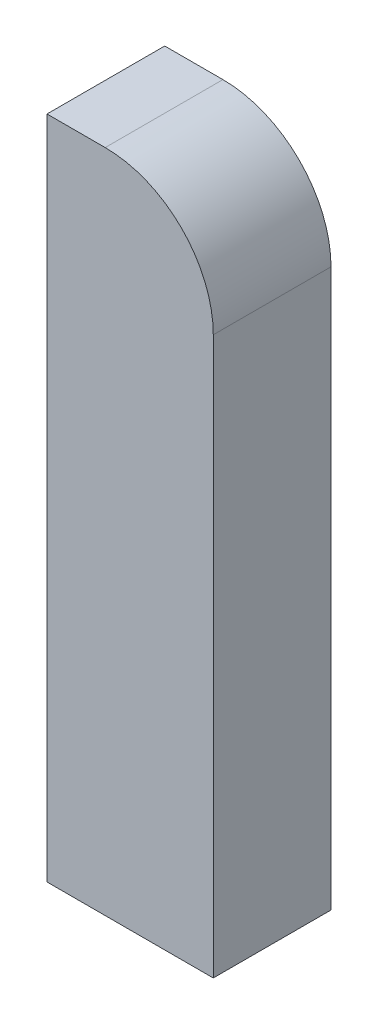
from build123d import *

# Parameters (mm, degrees)
SKETCH1_W           = 25.4
SKETCH1_H           = 101.6
BOSS_EXTRUDE1_DEPTH = 17.9832
FILLET1_R           = 16.51


with BuildPart() as part:
    # Sketch1 → Boss-Extrude1 (new body)
    with BuildSketch(Plane.XY):
        with Locations((12.7, 50.8)):
            Rectangle(SKETCH1_W, SKETCH1_H)
    extrude(amount=BOSS_EXTRUDE1_DEPTH)

    # Fillet1
    fillet1_edges = [part.edges().sort_by_distance(p)[0] for p in [
        (25.4, 101.6, 8.9916),
    ]]
    fillet(fillet1_edges, radius=FILLET1_R)


solid = part.part
